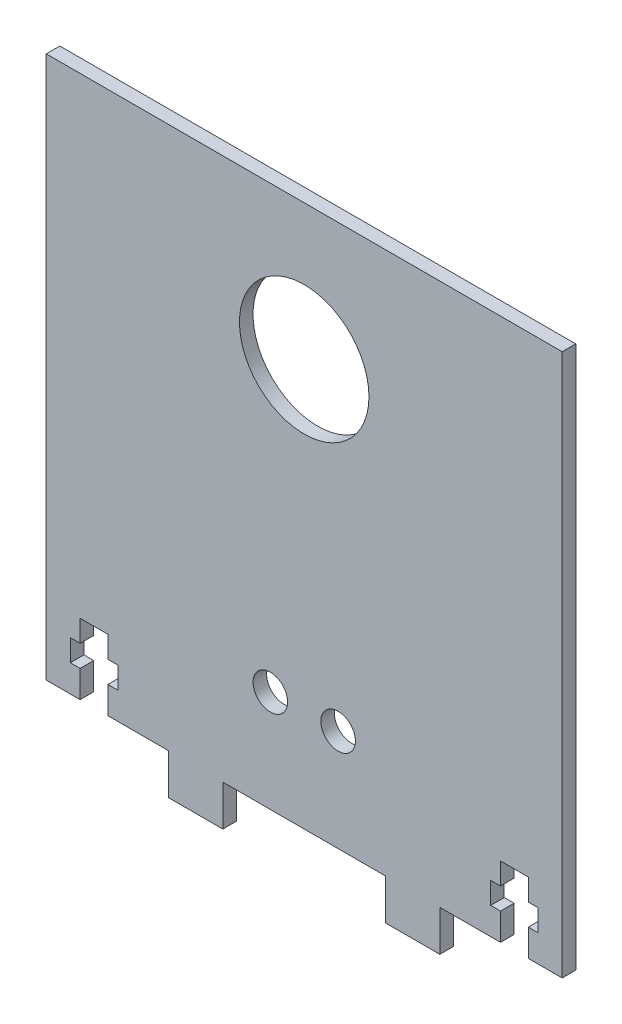
from build123d import *

# Parameters (mm, degrees)
SKETCH_1_R      = 9.55
SKETCH_1_R_2    = 2.55
EXTRUDE_1_DEPTH = 2


with BuildPart() as part:
    # 草图1 → 凸台-拉伸1 (new body)
    with BuildSketch(Plane.XY):
        Polygon((-28.741188564, 3.13029316), (-28.741188564, 7.13029316), (-27.291188564, 7.13029316), (-27.291188564, 10.33029316), (-28.741188564, 10.33029316), (-28.741188564, 13.53029316), (-32.841188564, 13.53029316), (-32.841188564, 10.33029316), (-34.291188564, 10.33029316), (-34.291188564, 7.13029316), (-32.841188564, 7.13029316), (-32.841188564, 3.13029316), (-37.841188564, 3.13029316), (-37.841188564, 83.13029316), (38.258811436, 83.13029316), (38.258811436, 3.13029316), (33.258811436, 3.13029316), (33.258811436, 7.13029316), (34.708811436, 7.13029316), (34.708811436, 10.33029316), (33.258811436, 10.33029316), (33.258811436, 13.53029316), (29.158811436, 13.53029316), (29.158811436, 10.33029316), (27.708811436, 10.33029316), (27.708811436, 7.13029316), (29.158811436, 7.13029316), (29.158811436, 3.13029316), (20.208811436, 3.13029316), (20.208811436, -2.86970684), (12.208811436, -2.86970684), (12.208811436, 3.13029316), (-11.791188564, 3.13029316), (-11.791188564, -2.86970684), (-19.791188564, -2.86970684), (-19.791188564, 3.13029316), align=None)
        with Locations((0.208811436, 63.13029316)):
            Circle(SKETCH_1_R, mode=Mode.SUBTRACT)
        with Locations((-4.791188564, 18.13029316)):
            Circle(SKETCH_1_R_2, mode=Mode.SUBTRACT)
        with Locations(Location((5.208811436, 18.13029316, 0), (0, 0, 180))):
            Circle(SKETCH_1_R_2, mode=Mode.SUBTRACT)
    extrude(amount=EXTRUDE_1_DEPTH)


solid = part.part
